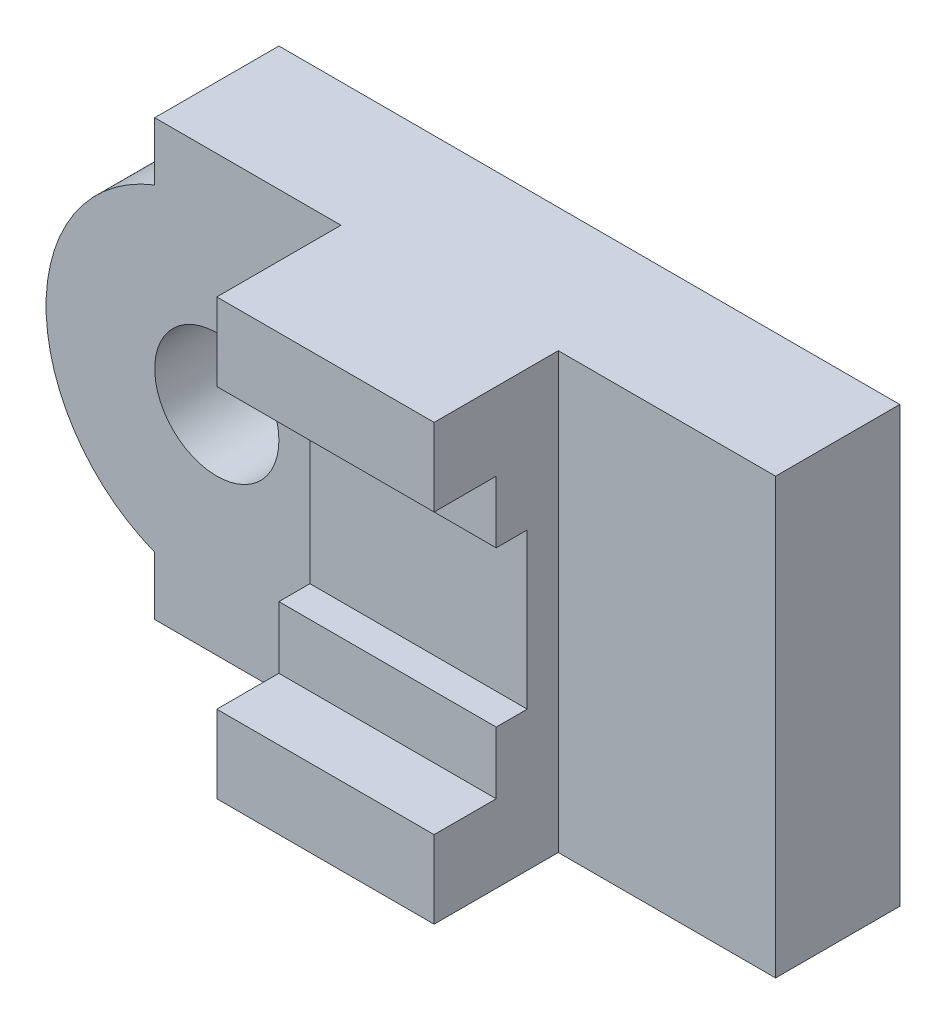
from build123d import *

# Parameters (mm, degrees)
SKETCH_1_R      = 10
EXTRUDE_1_DEPTH = 20
EXTRUDE_2_DEPTH = 35


with BuildPart() as part:
    # Эскиз1 → Бобышка-Вытянуть1 (new body)
    with BuildSketch(Plane.XY):
        with BuildLine():
            Line((-50, -25.617376915), (-50, -35))
            Line((-50, -35), (50, -35))
            Line((50, -35), (50, 35))
            Line((50, 35), (-50, 35))
            Line((-50, 35), (-50, 25.617376915))
            ThreePointArc((-50, 25.617376915), (-67.5, 0), (-50, -25.617376915))
        make_face()
        with Locations((-40, 0)):
            Circle(SKETCH_1_R, mode=Mode.SUBTRACT)
    extrude(amount=EXTRUDE_1_DEPTH)

    # Эскиз2 → Бобышка-Вытянуть2 (add)
    with BuildSketch(Plane.ZY.offset(20)):
        Polygon((0, 35), (0, -35), (40, -35), (40, -22.5), (30, -22.5), (30, -12.5), (25, -12.5), (25, 12.5), (30, 12.5), (30, 22.5), (40, 22.5), (40, 35), align=None)
    extrude(amount=-EXTRUDE_2_DEPTH)


solid = part.part
